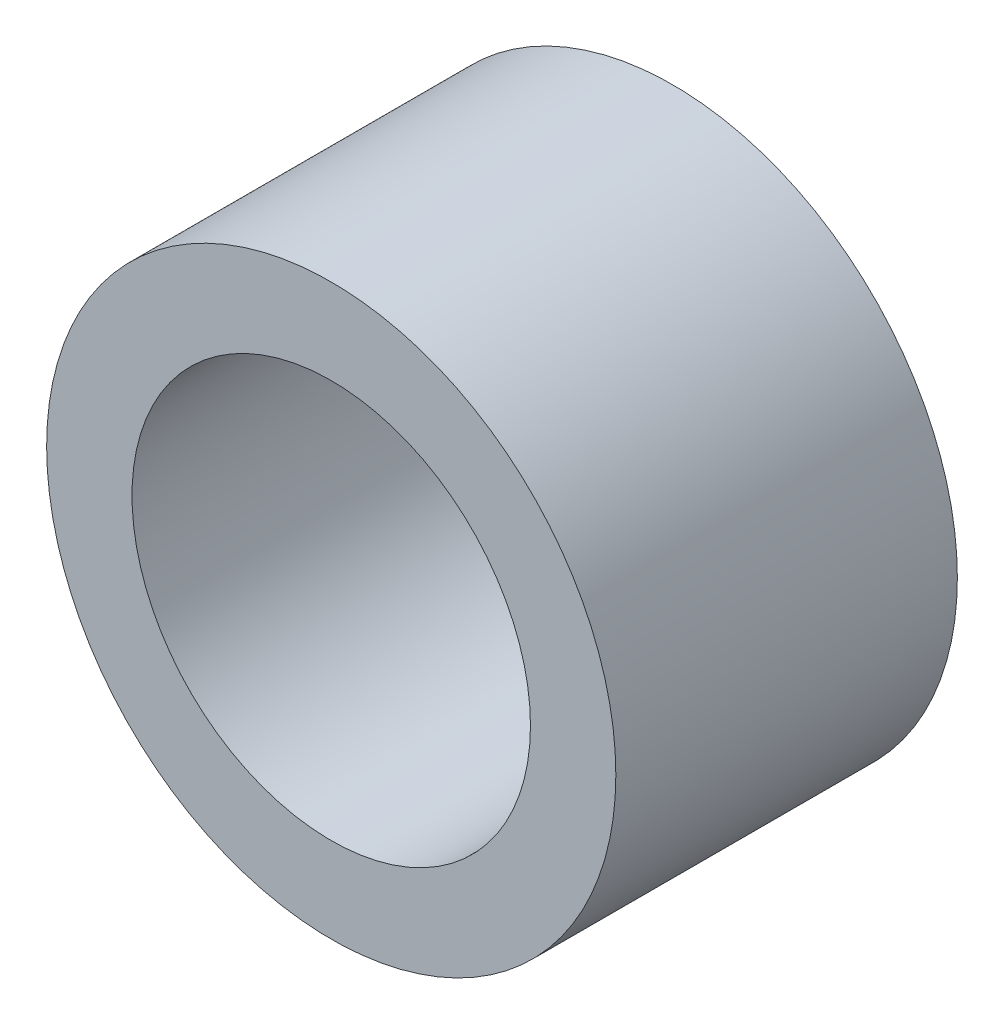
from build123d import *

# Parameters (mm, degrees)
SKETCH2_R           = 10
SKETCH2_R_2         = 7
BOSS_EXTRUDE1_DEPTH = 12
SCALE1_SCALE        = 0.95


with BuildPart() as part:
    # Sketch2 → Boss-Extrude1 (new body)
    with BuildSketch(Plane.XY):
        with Locations((-21.481032024, 16.973851197)):
            Circle(SKETCH2_R)
        with Locations((-21.481032024, 16.973851197)):
            Circle(SKETCH2_R_2, mode=Mode.SUBTRACT)
    extrude(amount=BOSS_EXTRUDE1_DEPTH)


with BuildPart() as part_1:
    # Scale1: scaled about (-21.481032024, 16.973851197, 6)
    add(part.part.scale(SCALE1_SCALE).moved(Location((-1.074051601, 0.84869256, 0.3))))


solid = part_1.part
